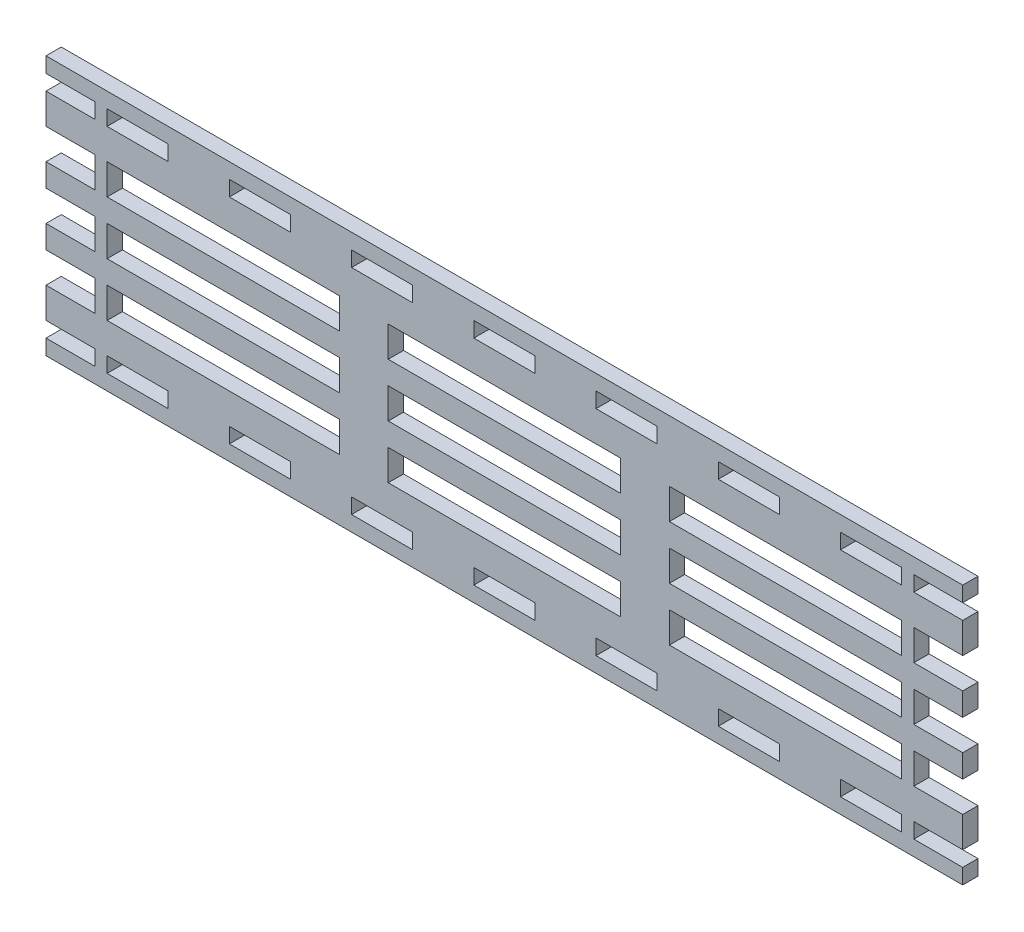
from build123d import *

# Parameters (mm, degrees)
SKETCH1_W           = 38
SKETCH1_H           = 5
SKETCH1_W_2         = 10
SKETCH1_H_2         = 2.5
BOSS_EXTRUDE1_DEPTH = 1.25


with BuildPart() as part:
    # Sketch1 → Boss-Extrude1 (new, symmetric)
    with BuildSketch(Plane.XY):
        Polygon((-75, 6.25), (-75, 2.5), (-67, 2.5), (-67, -2.5), (-75, -2.5), (-75, -6.25), (-67, -6.25), (-67, -11.25), (-75, -11.25), (-75, -16.25), (-67, -16.25), (-67, -18.75), (-75, -18.75), (-75, -21.25), (75, -21.25), (75, -18.75), (67, -18.75), (67, -16.25), (75, -16.25), (75, -11.25), (67, -11.25), (67, -6.25), (75, -6.25), (75, -2.5), (67, -2.5), (67, 2.5), (75, 2.5), (75, 6.25), (67, 6.25), (67, 11.25), (75, 11.25), (75, 16.25), (67, 16.25), (67, 18.75), (75, 18.75), (75, 21.25), (-75, 21.25), (-75, 18.75), (-67, 18.75), (-67, 16.25), (-75, 16.25), (-75, 11.25), (-67, 11.25), (-67, 6.25), align=None)
        with Locations((0, 8.75)):
            Rectangle(SKETCH1_W, SKETCH1_H, mode=Mode.SUBTRACT)
        Rectangle(SKETCH1_W, SKETCH1_H, mode=Mode.SUBTRACT)
        with Locations((0, -17.5)):
            Rectangle(SKETCH1_W_2, SKETCH1_H_2, mode=Mode.SUBTRACT)
        with Locations((0, 17.5)):
            Rectangle(SKETCH1_W_2, SKETCH1_H_2, mode=Mode.SUBTRACT)
        with Locations((20, 17.5)):
            Rectangle(SKETCH1_W_2, SKETCH1_H_2, mode=Mode.SUBTRACT)
        with Locations((20, -17.5)):
            Rectangle(SKETCH1_W_2, SKETCH1_H_2, mode=Mode.SUBTRACT)
        with Locations((40, 17.5)):
            Rectangle(SKETCH1_W_2, SKETCH1_H_2, mode=Mode.SUBTRACT)
        with Locations((40, -17.5)):
            Rectangle(SKETCH1_W_2, SKETCH1_H_2, mode=Mode.SUBTRACT)
        with Locations((60, 17.5)):
            Rectangle(SKETCH1_W_2, SKETCH1_H_2, mode=Mode.SUBTRACT)
        with Locations((60, -17.5)):
            Rectangle(SKETCH1_W_2, SKETCH1_H_2, mode=Mode.SUBTRACT)
        with Locations((-20, -17.5)):
            Rectangle(SKETCH1_W_2, SKETCH1_H_2, mode=Mode.SUBTRACT)
        with Locations((-20, 17.5)):
            Rectangle(SKETCH1_W_2, SKETCH1_H_2, mode=Mode.SUBTRACT)
        with Locations((-40, -17.5)):
            Rectangle(SKETCH1_W_2, SKETCH1_H_2, mode=Mode.SUBTRACT)
        with Locations((-40, 17.5)):
            Rectangle(SKETCH1_W_2, SKETCH1_H_2, mode=Mode.SUBTRACT)
        with Locations((-60, -17.5)):
            Rectangle(SKETCH1_W_2, SKETCH1_H_2, mode=Mode.SUBTRACT)
        with Locations((-60, 17.5)):
            Rectangle(SKETCH1_W_2, SKETCH1_H_2, mode=Mode.SUBTRACT)
        with Locations((0, -8.75)):
            Rectangle(SKETCH1_W, SKETCH1_H, mode=Mode.SUBTRACT)
        with Locations((-46, 0)):
            Rectangle(SKETCH1_W, SKETCH1_H, mode=Mode.SUBTRACT)
        with Locations((-46, 8.75)):
            Rectangle(SKETCH1_W, SKETCH1_H, mode=Mode.SUBTRACT)
        with Locations((-46, -8.75)):
            Rectangle(SKETCH1_W, SKETCH1_H, mode=Mode.SUBTRACT)
        with Locations((46, 8.75)):
            Rectangle(SKETCH1_W, SKETCH1_H, mode=Mode.SUBTRACT)
        with Locations((46, 0)):
            Rectangle(SKETCH1_W, SKETCH1_H, mode=Mode.SUBTRACT)
        with Locations((46, -8.75)):
            Rectangle(SKETCH1_W, SKETCH1_H, mode=Mode.SUBTRACT)
    extrude(amount=BOSS_EXTRUDE1_DEPTH, both=True)


solid = part.part
